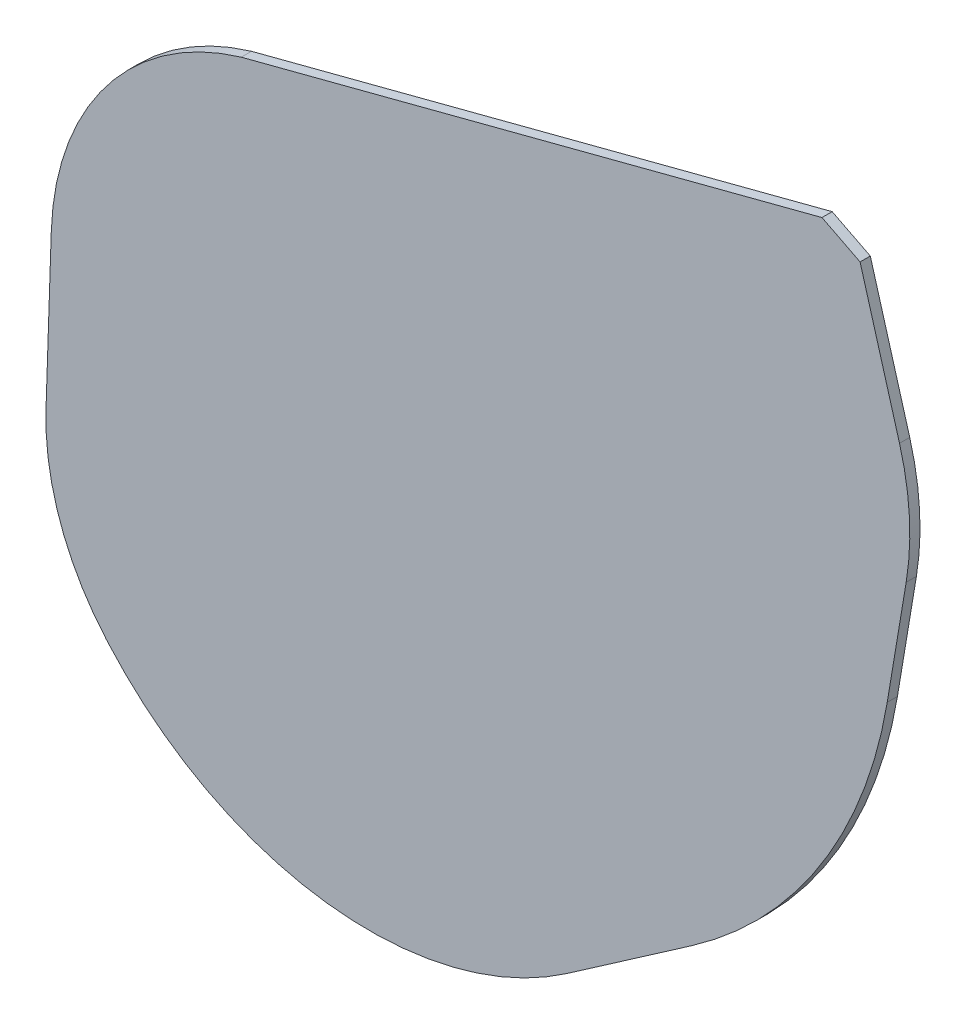
from build123d import *

# Parameters (mm, degrees)
BOSS_EXTRUDE1_DEPTH = 2.54


with BuildPart() as part:
    # Sketch2 → Boss-Extrude1 (new body)
    with BuildSketch(Plane.XY):
        with BuildLine():
            Line((52.480544155, 258.674987582), (196.894837031, 296.342844243))
            Line((196.894837031, 296.342844243), (206.373128662, 291.523930207))
            Line((206.373128662, 291.523930207), (216.178620917, 257.355486833))
            ThreePointArc((216.178620917, 257.355486833), (218.633828258, 242.895591751), (217.836941691, 228.250402074))
            Line((217.836941691, 228.250402074), (213.120538575, 200.036424744))
            ThreePointArc((213.120538575, 200.036424744), (196.554033533, 156.731222664), (164.448728673, 123.279182124))
            Line((164.448728673, 123.279182124), (133.560538269, 101.865242067))
            ThreePointArc((133.560538269, 101.865242067), (73.755681182, 87.130889432), (19.343587989, 115.99342905))
            Line((19.343587989, 115.99342905), (18.948822289, 116.444928865))
            ThreePointArc((18.948822289, 116.444928865), (7.419590663, 136.102703369), (3.91533799, 158.620951381))
            Line((3.91533799, 158.620951381), (5.226431104, 197.573753427))
            ThreePointArc((5.226431104, 197.573753427), (18.98894665, 235.75335118), (52.480544155, 258.674987582))
        make_face()
    extrude(amount=BOSS_EXTRUDE1_DEPTH)


solid = part.part
